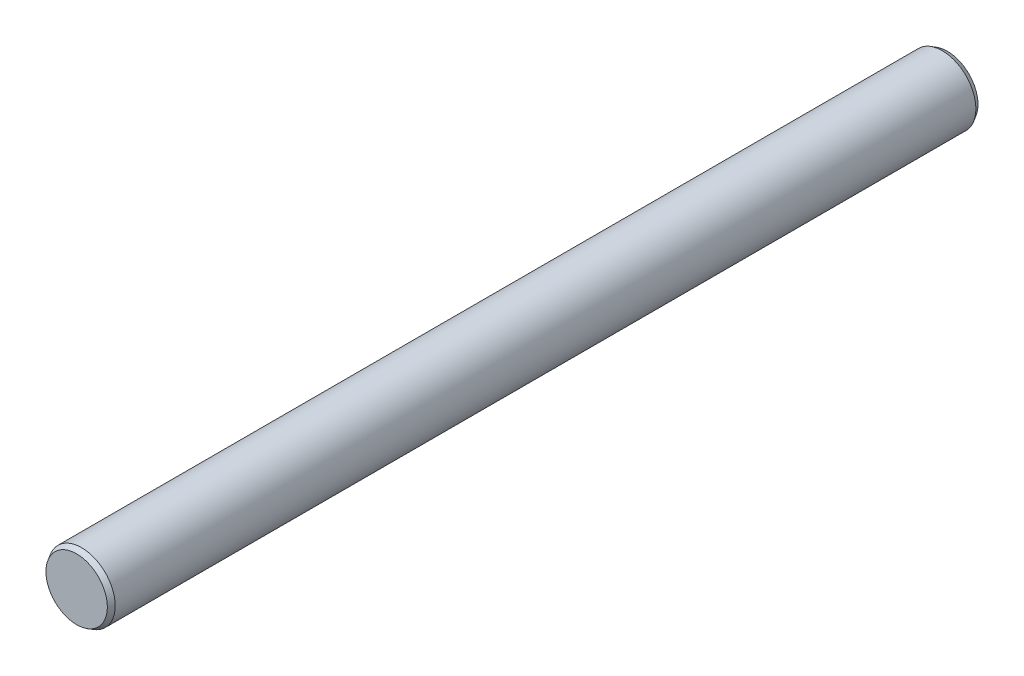
from build123d import *

# Parameters (mm, degrees)
SKETCH2_R      = 1.7145
EXTRUDE1_DEPTH = 22.225
CHAMFER1_SIZE  = 0.254
CHAMFER1_SIZE2 = 0.146646968


with BuildPart() as part:
    # Sketch2 → Extrude1 (new, symmetric)
    with BuildSketch(Plane.XY):
        Circle(SKETCH2_R)
    extrude(amount=EXTRUDE1_DEPTH, both=True)

    # Chamfer1
    chamfer1_edges = [part.edges().sort_by_distance(p)[0] for p in [
        (-1.7145, 0, -22.225),
        (-1.7145, 0, 22.225),
    ]]
    chamfer1_side = [part.faces().sort_by_distance(p)[0] for p in [
        (-1.7145, 0, 0),
    ]]
    chamfer(chamfer1_edges, length=CHAMFER1_SIZE, length2=CHAMFER1_SIZE2, reference=chamfer1_side[0])


solid = part.part
